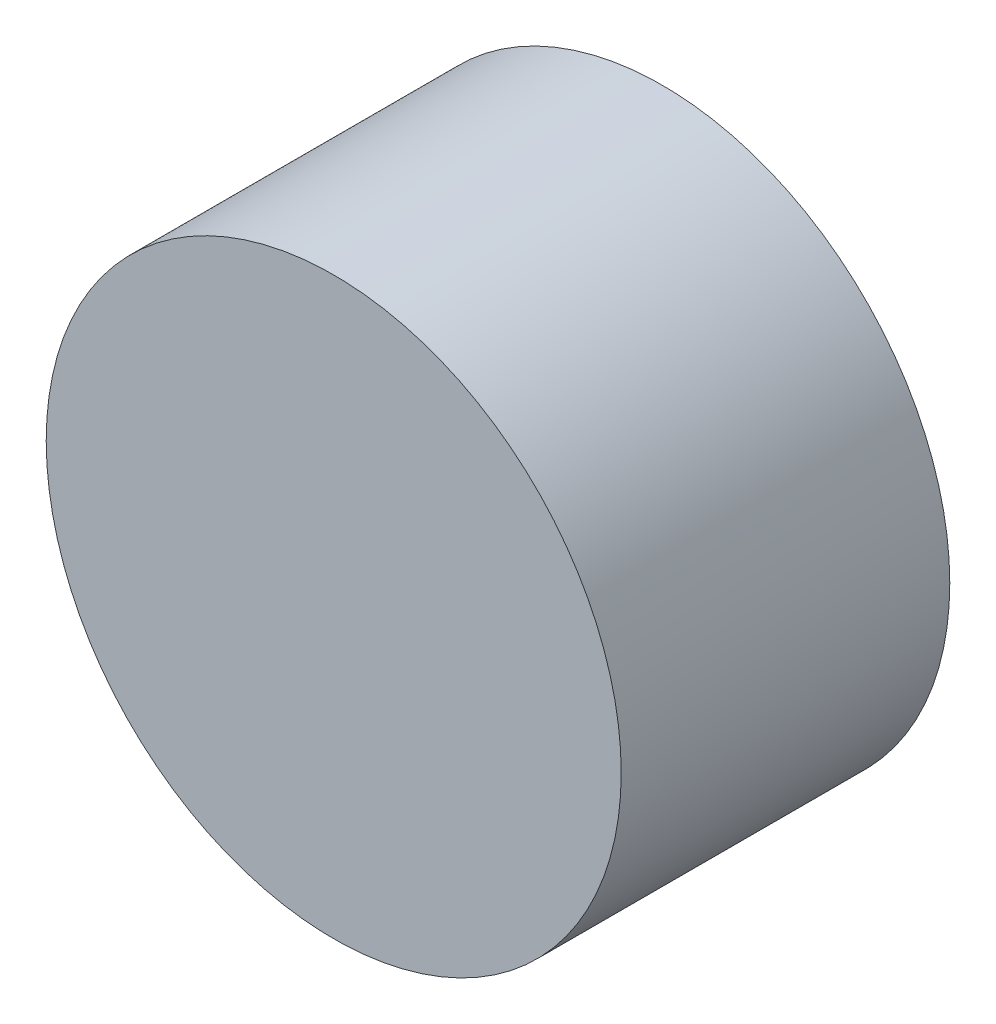
from build123d import *

# Parameters (mm, degrees)
SKETCH_2_R          = 14
EXTRUDE_1_DEPTH     = 16
SKETCH_3_R          = 9.5
CUT_EXTRUDE_1_DEPTH = 8
SKETCH_4_R          = 9.51
CUT_EXTRUDE_3_DEPTH = 8


with BuildPart() as part:
    # 草图2 → 凸台-拉伸1 (new body)
    with BuildSketch(Plane.XY):
        Circle(SKETCH_2_R)
    extrude(amount=EXTRUDE_1_DEPTH)

    # 草图3 → 切除-拉伸1 (cut)
    with BuildSketch(Plane(origin=(0, 0, 0), x_dir=(-1, 0, 0), z_dir=(0, 0, -1))):
        Circle(SKETCH_3_R)
    extrude(amount=-CUT_EXTRUDE_1_DEPTH, mode=Mode.SUBTRACT)

    # 草图4 → 切除-拉伸3 (cut)
    with BuildSketch(Plane(origin=(0, 0, 0), x_dir=(-1, 0, 0), z_dir=(0, 0, -1))):
        Circle(SKETCH_4_R)
    extrude(amount=-CUT_EXTRUDE_3_DEPTH, mode=Mode.SUBTRACT)


solid = part.part
